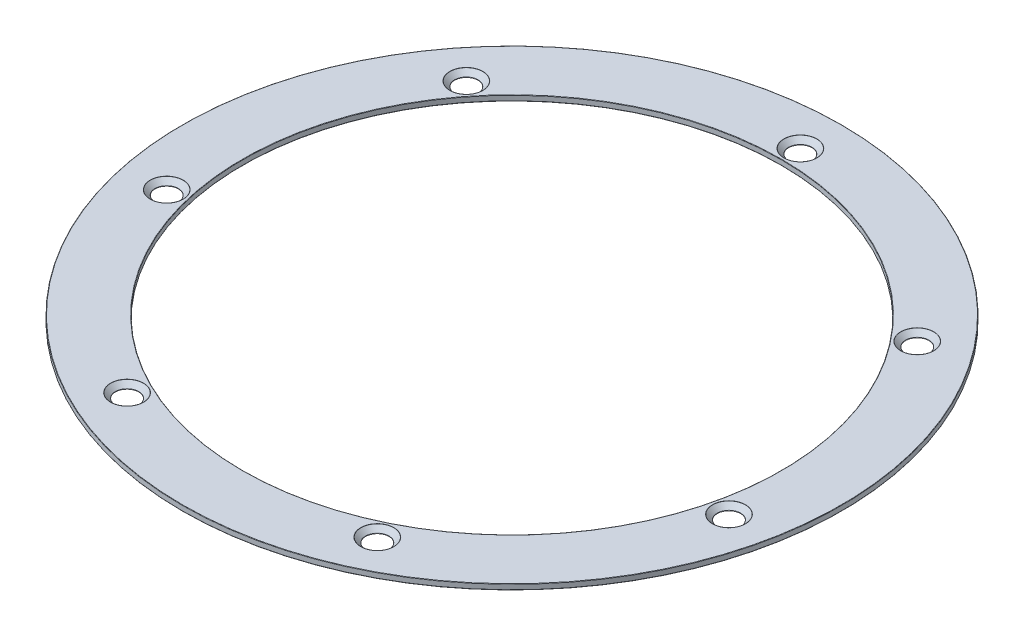
from build123d import *

# Parameters (mm, degrees)
SKIZZE1_R                       = 92
SKIZZE1_R_2                     = 75.2
AUFSATZ_LINEAR_AUSTRAGEN1_DEPTH = 1.5
KREISMUSTER1_COUNT              = 7
VERRUNDUNG1_R                   = 0.1


with BuildPart() as part:
    # Skizze1 → Aufsatz-Linear austragen1 (new body)
    with BuildSketch(Plane(origin=(0, 0, 0), x_dir=(1, 0, 0), z_dir=(0, 1, 0))):
        with Locations(Location((0, 0, 0), (0, 0, 270))):
            Circle(SKIZZE1_R)
        with Locations(Location((0, 0, 0), (0, 0, 270))):
            Circle(SKIZZE1_R_2, mode=Mode.SUBTRACT)
    extrude(amount=AUFSATZ_LINEAR_AUSTRAGEN1_DEPTH)

    # Skizze6 → Formsenkung für M4 Senkschraube mit Innensechskant1 (revolve, cut)
    with BuildSketch(Plane(origin=(0, 1.5, -80.5), x_dir=(0, 0, 1), z_dir=(1, 0, 0))):
        Polygon((0, 0), (0, 1.5), (2.25, 1.5), (2.25, 2.34), (4.59, 0), align=None)
    formsenkung_f_r_m4_senkschraube_mit_inne = revolve(axis=Axis((0, 7.85, -80.5), (0, -1, 0)), mode=Mode.SUBTRACT)

    # Kreismuster1: Formsenkung für M4 Senkschraube mit Innensechskant1 ×7 about axis
    kreismuster1_axis = Axis((0, 0, 0), (0, 1, 0))
    for i in range(1, KREISMUSTER1_COUNT):
        add(formsenkung_f_r_m4_senkschraube_mit_inne.rotate(kreismuster1_axis, i * 360 / KREISMUSTER1_COUNT), mode=Mode.SUBTRACT)

    # Verrundung1
    verrundung1_edges = [part.edges().sort_by_distance(p)[0] for p in [
        (0, 0, -83.59),
        (0, 1.5, -85.09),
        (0, 0, -92),
        (66.526040843, 1.5, -53.05274724),
        (65.35329362, 0, -52.117512537),
        (82.956616048, 1.5, 18.93430627),
        (81.494224179, 0, 18.600524869),
        (36.919167362, 1.5, 76.66344097),
        (36.268341753, 0, 75.311987668),
        (-36.919167362, 1.5, 76.66344097),
        (-36.268341753, 0, 75.311987668),
        (-82.956616048, 1.5, 18.93430627),
        (-81.494224179, 0, 18.600524869),
        (-66.526040843, 1.5, -53.05274724),
        (-65.35329362, 0, -52.117512537),
        (0, 1.5, -92),
        (0, 0, -75.2),
        (0, 1.5, -75.2),
    ]]
    fillet(verrundung1_edges, radius=VERRUNDUNG1_R)


solid = part.part
